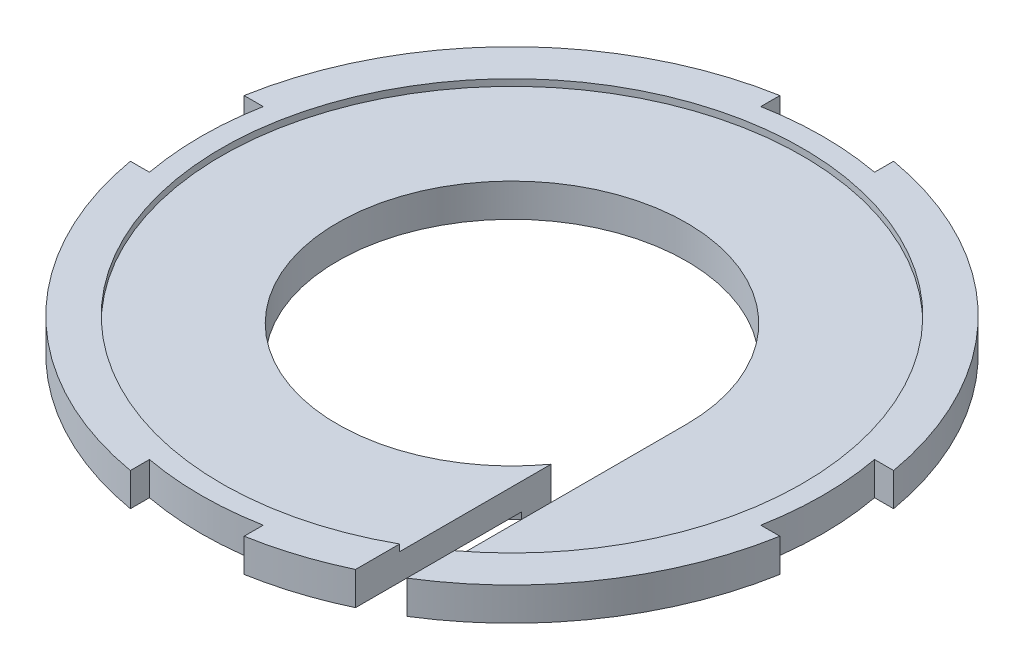
from build123d import *

# Parameters (mm, degrees)
SKETCH1_R           = 15.24
CUT_EXTRUDE1_START  = -3.81
CUT_EXTRUDE1_DEPTH  = 3.81
SKETCH17_R          = 33.401
CUT_EXTRUDE4_DEPTH  = 0.762
BOSS_EXTRUDE1_DEPTH = 0.762


with BuildPart() as part:
    # Sweep1: sweep along a path in Sketch14
    with BuildLine(Plane(origin=(0, 0, 0), x_dir=(0, 0, -1), z_dir=(1, 0, 0))) as sweep1_path:
        Line((35.814, 0), (35.814, 3.81))
    # Sketch1 → Sweep1 (sweep)
    with BuildSketch(Plane(origin=(0, 0, 0), x_dir=(1, 0, 0), z_dir=(0, 1, 0))):
        with BuildLine():
            Line((35.147120935, 6.5405), (37.341023687, 6.5405))
            ThreePointArc((37.341023687, 6.5405), (26.806064521, 26.806064521), (6.5405, 37.341023687))
            Line((6.5405, 37.341023687), (6.5405, 35.147120935))
            ThreePointArc((6.5405, 35.147120935), (0, 35.7505), (-6.5405, 35.147120935))
            Line((-6.5405, 35.147120935), (-6.5405, 37.341023687))
            ThreePointArc((-6.5405, 37.341023687), (-26.806064521, 26.806064521), (-37.341023687, 6.5405))
            Line((-37.341023687, 6.5405), (-35.147120935, 6.5405))
            ThreePointArc((-35.147120935, 6.5405), (-35.7505, 0), (-35.147120935, -6.5405))
            Line((-35.147120935, -6.5405), (-37.341023687, -6.5405))
            ThreePointArc((-37.341023687, -6.5405), (-26.806064521, -26.806064521), (-6.5405, -37.341023687))
            Line((-6.5405, -37.341023687), (-6.5405, -35.147120935))
            ThreePointArc((-6.5405, -35.147120935), (0, -35.7505), (6.5405, -35.147120935))
            Line((6.5405, -35.147120935), (6.5405, -37.341023687))
            ThreePointArc((6.5405, -37.341023687), (26.806064521, -26.806064521), (37.341023687, -6.5405))
            Line((37.341023687, -6.5405), (35.147120935, -6.5405))
            ThreePointArc((35.147120935, -6.5405), (35.7505, 0), (35.147120935, 6.5405))
        make_face()
        Circle(SKETCH1_R, mode=Mode.SUBTRACT)
    sweep(path=sweep1_path.line)

    # Sketch2 → Cut-Extrude1 (cut)
    with BuildSketch(Plane.XZ.offset(CUT_EXTRUDE1_START)):
        with BuildLine():
            Line((16.256, 37.235541419), (16.256, 11.763792756))
            ThreePointArc((16.256, 11.763792756), (-19.089751858, -6.182696014), (20.066, 0))
            Line((20.066, 0), (20.066, 35.328440735))
            ThreePointArc((20.066, 35.328440735), (18.186016036, 36.331968038), (16.256, 37.235541419))
        make_face()
    extrude(amount=CUT_EXTRUDE1_DEPTH, mode=Mode.SUBTRACT)

    # Sketch17 → Cut-Extrude4 (cut)
    with BuildSketch(Plane.XZ.offset(-3.81)):
        Circle(SKETCH17_R)
    extrude(amount=CUT_EXTRUDE4_DEPTH, mode=Mode.SUBTRACT)

    # Sketch19 → Boss-Extrude1 (add)
    with BuildSketch(Plane.XZ):
        with BuildLine():
            Line((16.256, 11.763792756), (16.256, 15.155628954))
            ThreePointArc((16.256, 15.155628954), (-18.375594526, -12.501525939), (20.066, 9.555431387))
            Line((20.066, 9.555431387), (20.066, 0))
            ThreePointArc((20.066, 0), (-19.089751858, -6.182696014), (16.256, 11.763792756))
        make_face()
    extrude(amount=BOSS_EXTRUDE1_DEPTH)


solid = part.part
